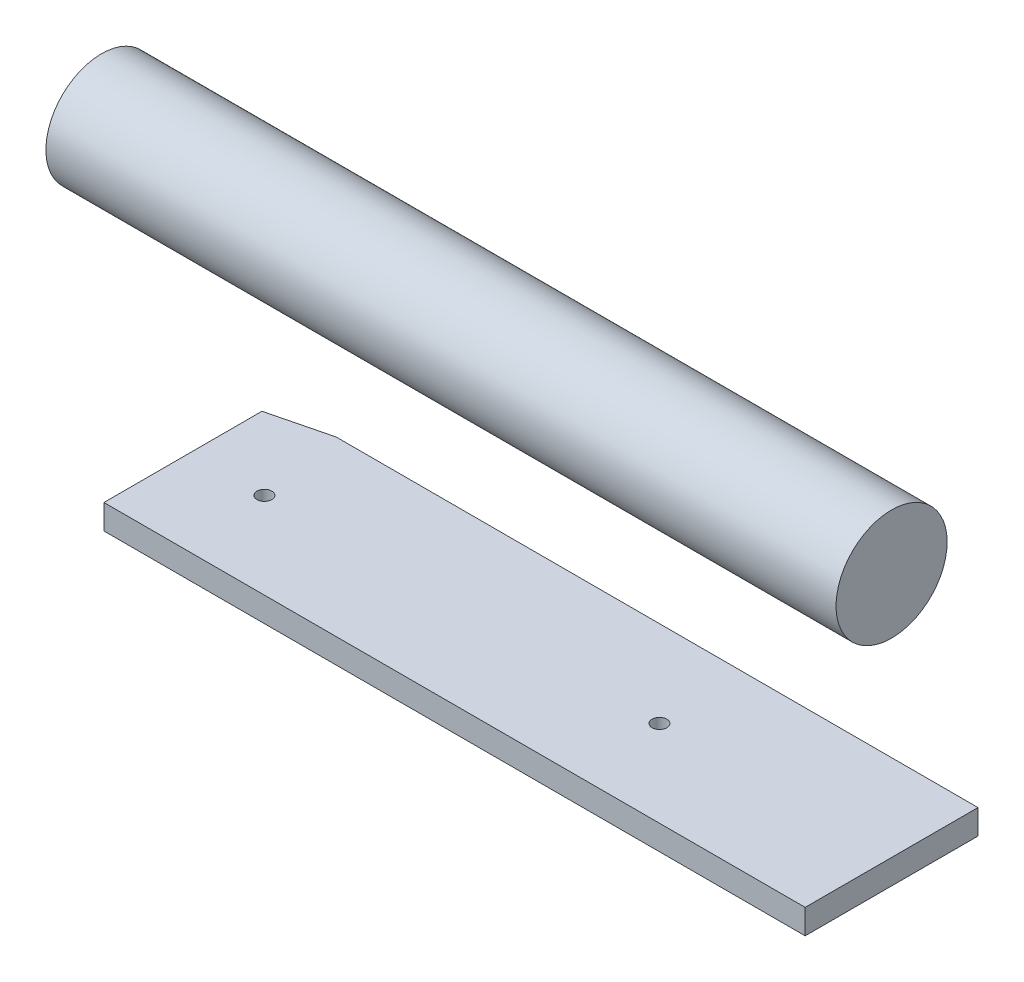
from build123d import *

# Parameters (mm, degrees)
SKETCH1_R           = 11.25
BOSS_EXTRUDE1_DEPTH = 160
SKETCH3_R           = 1.5
BOSS_EXTRUDE2_DEPTH = 5


with BuildPart() as part:
    # Sketch1 → Boss-Extrude1 (new body)
    with BuildSketch(Plane(origin=(0, 0, 0), x_dir=(0, 0, -1), z_dir=(1, 0, 0))):
        with Locations((0, 54.7)):
            Circle(SKETCH1_R)
    extrude(amount=BOSS_EXTRUDE1_DEPTH)


with BuildPart() as body_2:
    # Sketch3 → Boss-Extrude2 (new body)
    with BuildSketch(Plane(origin=(0, 0, 0), x_dir=(1, 0, 0), z_dir=(0, 1, 0))):
        Polygon((160, 17.5), (30.032342801, 17.5), (18, 14.5), (18, -17.5), (160, -17.5), align=None)
        with Locations(Location((33, 0, 0), (0, 0, 270))):
            Circle(SKETCH3_R, mode=Mode.SUBTRACT)
        with Locations(Location((113, 0, 0), (0, 0, 270))):
            Circle(SKETCH3_R, mode=Mode.SUBTRACT)
    extrude(amount=BOSS_EXTRUDE2_DEPTH)


solid = Compound([part.part, body_2.part])
